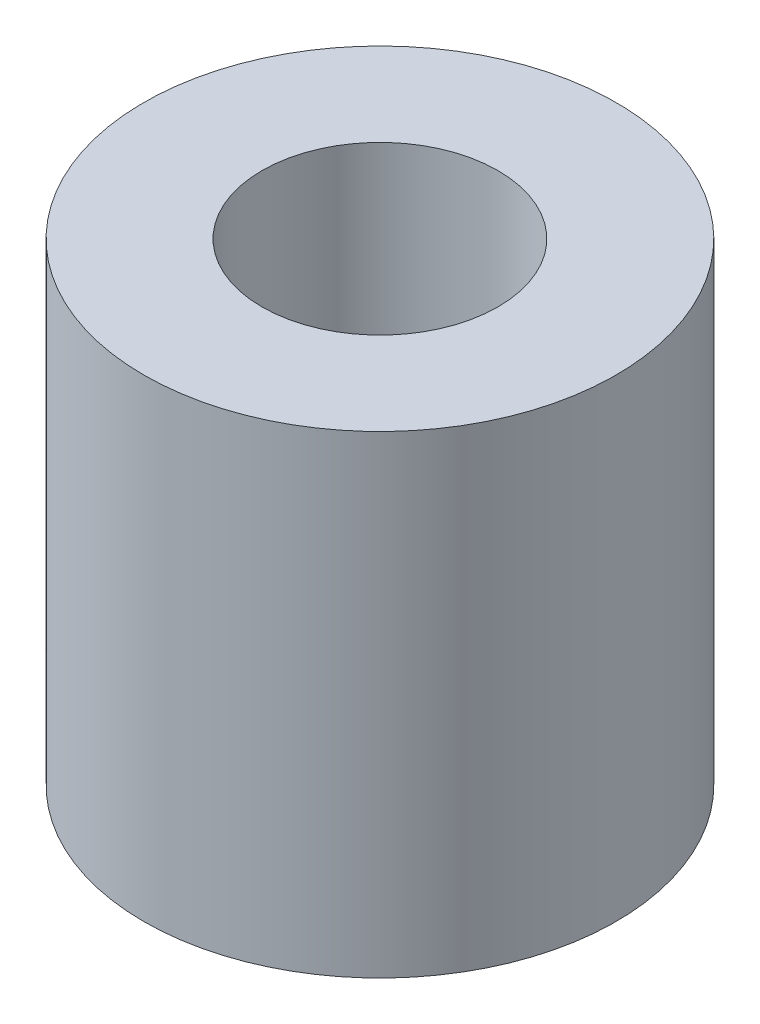
from build123d import *

# Parameters (mm, degrees)
ESQUISSE1_R        = 4
ESQUISSE1_R_2      = 2
BOSS_EXTRU_1_DEPTH = 4.00982222


with BuildPart() as part:
    # Esquisse1 → Boss.-Extru.1 (new, symmetric)
    with BuildSketch(Plane(origin=(0, 0, 0), x_dir=(1, 0, 0), z_dir=(0, 1, 0))):
        with Locations(Location((0, 0, 0), (0, 0, 270))):
            Circle(ESQUISSE1_R)
        with Locations(Location((0, 0, 0), (0, 0, 270))):
            Circle(ESQUISSE1_R_2, mode=Mode.SUBTRACT)
    extrude(amount=BOSS_EXTRU_1_DEPTH, both=True)


solid = part.part
